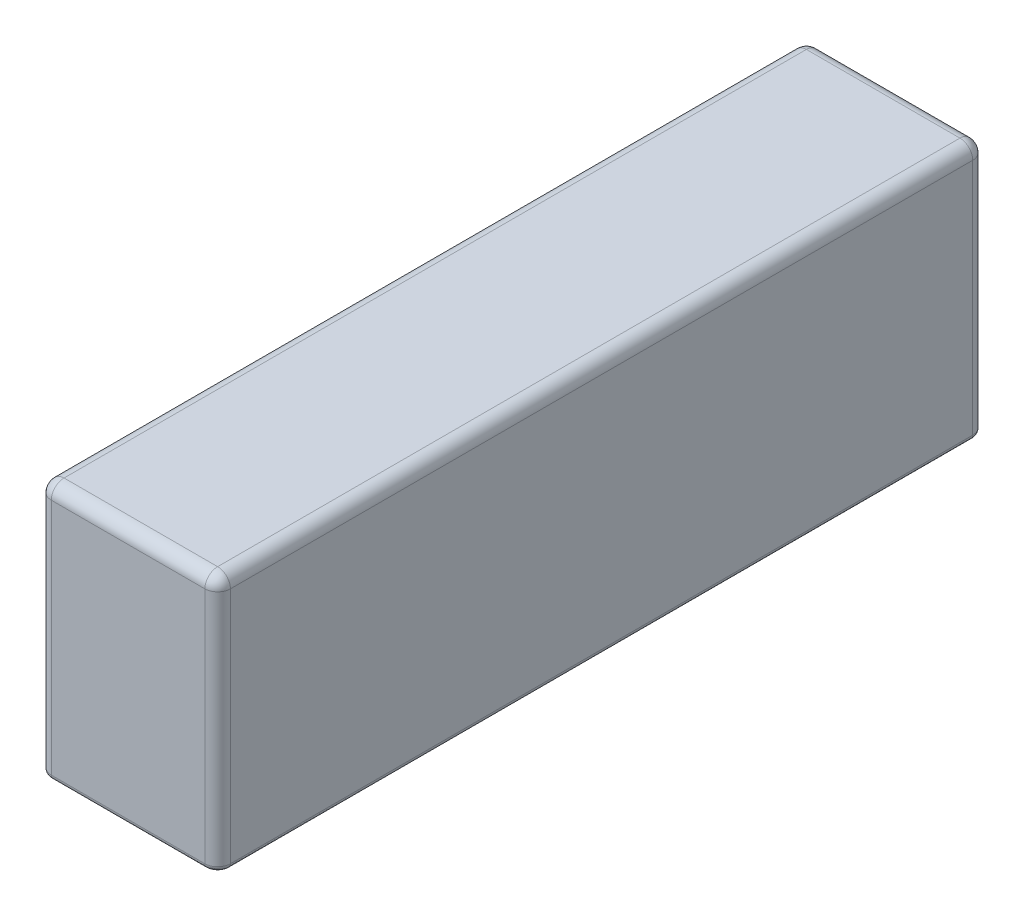
from build123d import *

# Parameters (mm, degrees)
SKETCH1_W           = 7
SKETCH1_H           = 30
BOSS_EXTRUDE1_DEPTH = 5
FILLET1_R           = 0.5
FILLET2_R           = 0.2


with BuildPart() as part:
    # Sketch1 → Boss-Extrude1 (new, symmetric)
    with BuildSketch(Plane(origin=(0, 0, 0), x_dir=(1, 0, 0), z_dir=(0, 1, 0))):
        Rectangle(SKETCH1_W, SKETCH1_H)
    extrude(amount=BOSS_EXTRUDE1_DEPTH, both=True)

    # Fillet1
    fillet1_edges = [part.edges().sort_by_distance(p)[0] for p in [
        (-3.5, 5, 0),
        (0, 5, 15),
        (3.5, 5, 0),
        (3.5, 0, 15),
        (-3.5, 0, 15),
        (-3.5, 0, -15),
        (3.5, 0, -15),
        (0, 5, -15),
    ]]
    fillet(fillet1_edges, radius=FILLET1_R)

    # Fillet2
    fillet2_edges = [part.edges().sort_by_distance(p)[0] for p in [
        (0, -5, 15),
        (-3.5, -5, 0),
        (0, -5, -15),
        (3.5, -5, 0),
        (3.353553391, -5, 14.853553391),
        (-3.353553391, -5, 14.853553391),
        (3.353553391, -5, -14.853553391),
        (-3.353553391, -5, -14.853553391),
    ]]
    fillet(fillet2_edges, radius=FILLET2_R)


solid = part.part
